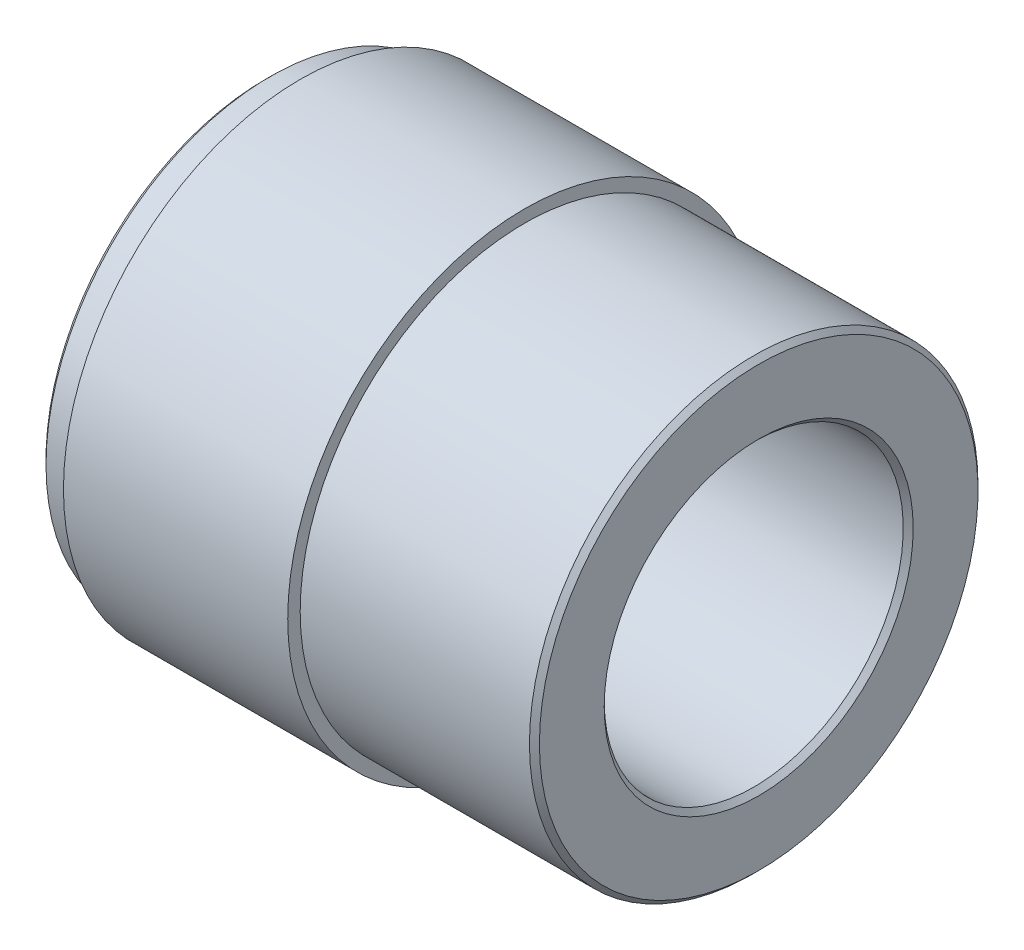
from build123d import *

# Parameters (mm, degrees)
CHAMFER_1_SIZE = 1


with BuildPart() as part:
    # 草图1 → 旋转1 (revolve)
    with BuildSketch(Plane.XY, mode=Mode.PRIVATE) as revolve_1_sk:
        Polygon((0, 45), (7, 45), (7, 47.5), (52, 47.5), (52, 45), (99, 45), (99, 30), (6.7, 30), (6.7, 31.5), (4.5, 31.5), (4.5, 30), (0, 30), align=None)
    revolve(revolve_1_sk.sketch.rotate(Axis((0, 0, 0), (1, 0, 0)), 90), axis=Axis((0, 0, 0), (1, 0, 0)))

    # 倒角1
    chamfer_1_edges = [part.edges().sort_by_distance(p)[0] for p in [
        (99, 0, -45),
        (99, 0, -30),
        (0, 0, -30),
        (0, 0, -45),
    ]]
    chamfer(chamfer_1_edges, length=CHAMFER_1_SIZE)


solid = part.part
